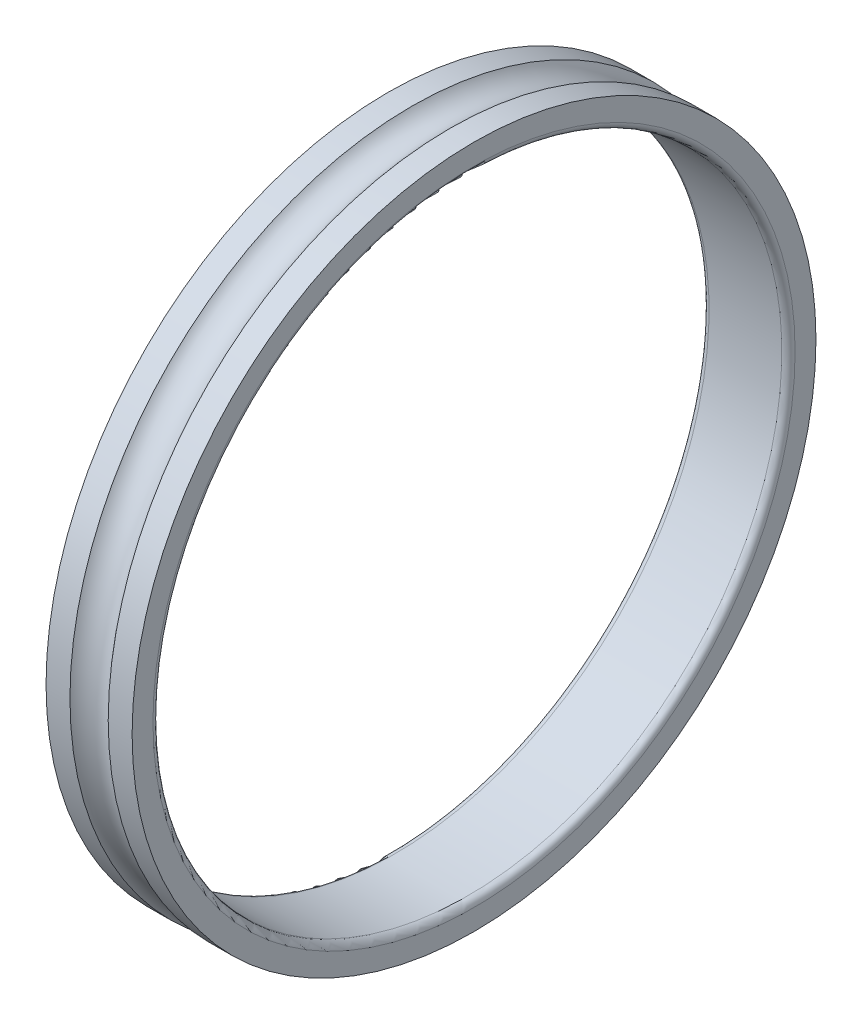
from build123d import *


with BuildPart() as part:
    # Schizzo1 → Rivoluzione1 (revolve)
    with BuildSketch(Plane.XY, mode=Mode.PRIVATE) as rivoluzione1_sk:
        with BuildLine():
            Line((1, 47.5), (12, 47.5))
            ThreePointArc((12, 47.5), (12.707106781, 47.792893219), (13, 48.5))
            Line((13, 48.5), (13, 51.65))
            Line((13, 51.65), (9.389495458, 51.65))
            ThreePointArc((9.389495458, 51.65), (6.5, 50.178), (3.610504542, 51.65))
            Line((3.610504542, 51.65), (0, 51.65))
            Line((0, 51.65), (0, 48.5))
            ThreePointArc((0, 48.5), (0.292893219, 47.792893219), (1, 47.5))
        make_face()
    revolve(rivoluzione1_sk.sketch.rotate(Axis((50, 0, 0), (-1, 0, 0)), 270), axis=Axis((50, 0, 0), (-1, 0, 0)))


solid = part.part
